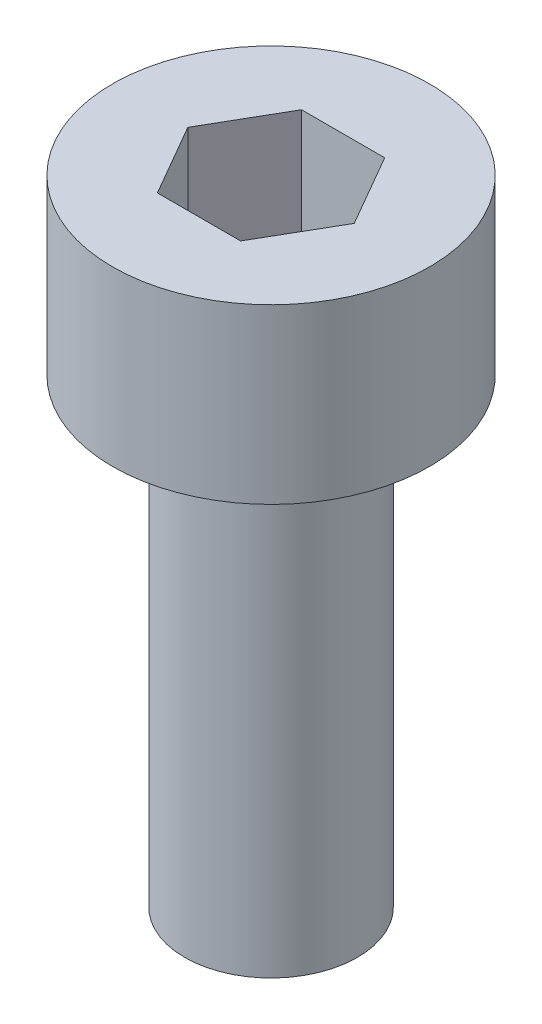
from build123d import *

# Parameters (mm, degrees)
CUT_EXTRUDE1_DEPTH = 2.5


with BuildPart() as part:
    # Sketch1 → Revolve1 (revolve)
    with BuildSketch(Plane.XY, mode=Mode.PRIVATE) as revolve1_sk:
        Polygon((0, -8), (1.5, -8), (1.5, 0), (2.75, 0), (2.75, 3), (0, 3), align=None)
    revolve(revolve1_sk.sketch.rotate(Axis((0, 61.691642626, 0), (0, -1, 0)), 90), axis=Axis((0, 61.691642626, 0), (0, -1, 0)))

    # Sketch2 → Cut-Extrude1 (cut)
    with BuildSketch(Plane(origin=(0, 3, 0), x_dir=(-1, 0, 0), z_dir=(0, 1, 0))):
        Polygon((-0.721687836, -1.25), (0.721687836, -1.25), (1.443375673, 0), (0.721687836, 1.25), (-0.721687836, 1.25), (-1.443375673, 0), align=None)
    extrude(amount=-CUT_EXTRUDE1_DEPTH, mode=Mode.SUBTRACT)


solid = part.part
